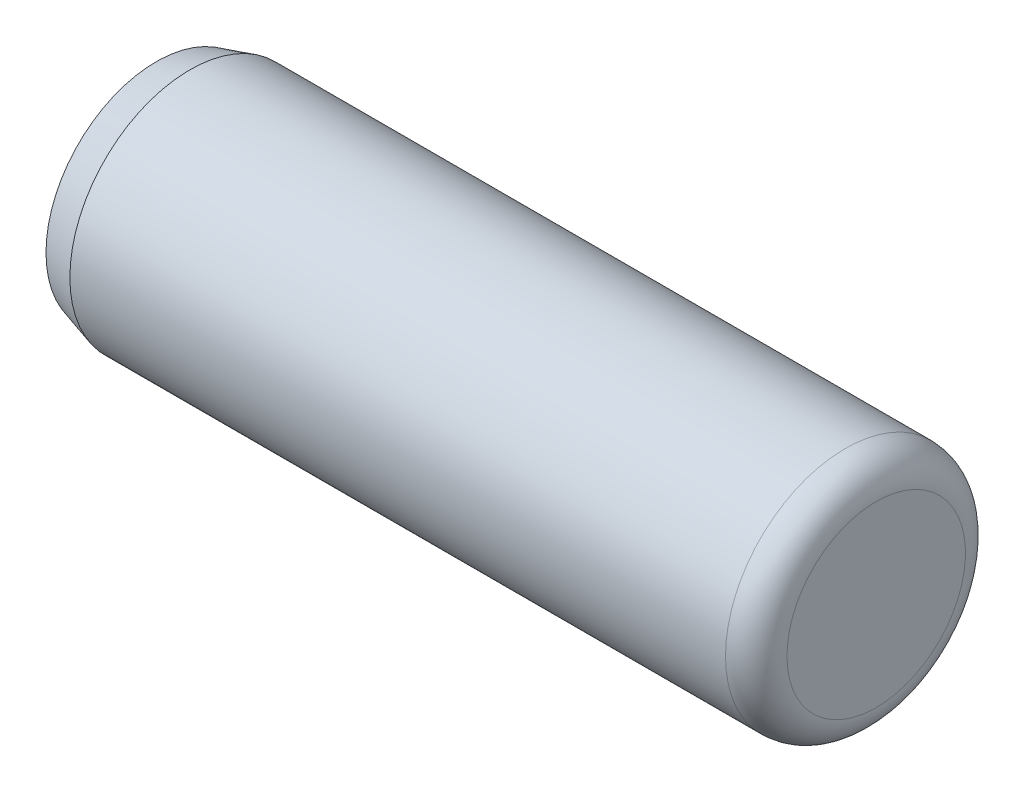
from build123d import *


with BuildPart() as part:
    # Sketch3 → Revolve1 (revolve)
    with BuildSketch(Plane.XY, mode=Mode.PRIVATE) as revolve1_sk:
        with BuildLine():
            Line((4.7625, 1.1811), (4.7625, 0))
            Line((4.7625, 0), (-4.7625, 0))
            Line((-4.7625, 0), (-4.7625, 1.4605))
            Line((-4.7625, 1.4605), (-4.319598366, 1.5875))
            Line((-4.319598366, 1.5875), (4.3561, 1.5875))
            ThreePointArc((4.3561, 1.5875), (4.643468196, 1.468468196), (4.7625, 1.1811))
        make_face()
    revolve(revolve1_sk.sketch.rotate(Axis((-4.7625, 0, 0), (1, 0, 0)), 90), axis=Axis((-4.7625, 0, 0), (1, 0, 0)))


solid = part.part
